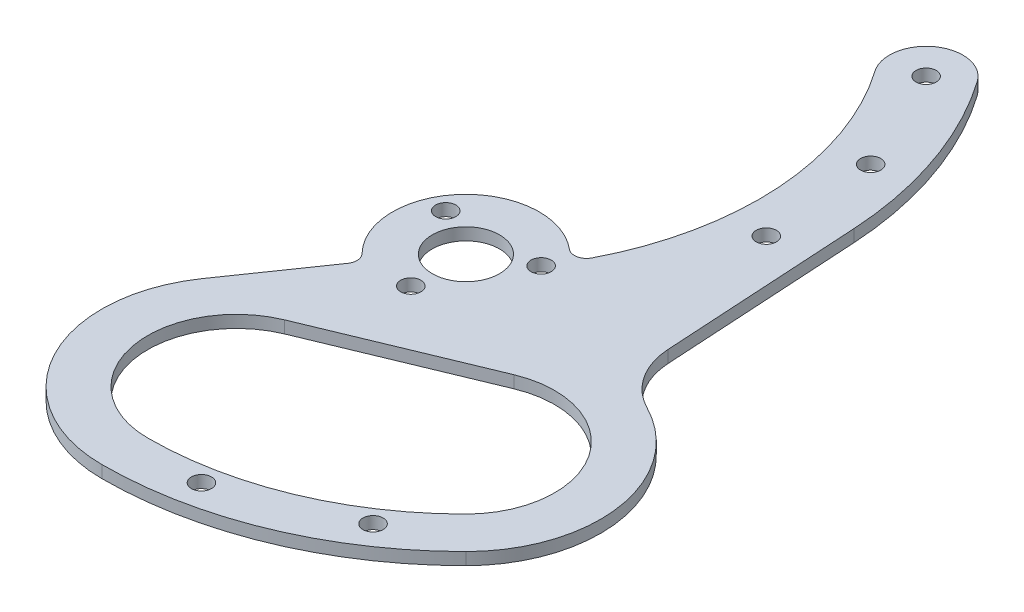
from build123d import *

# Parameters (mm, degrees)
SKETCH_1_R          = 1.65
SKETCH_1_R_2        = 5.5
EXTRUDE_1_DEPTH     = 2
SKETCH_2_R          = 1.65
CUT_EXTRUDE_1_DEPTH = 85.204030668
FILLET_1_R          = 2
FILLET_2_R          = 12


with BuildPart() as part:
    # Эскиз1 → Бобышка-Вытянуть1 (new body)
    with BuildSketch(Plane(origin=(0, 0, 0), x_dir=(1, 0, 0), z_dir=(0, 1, 0))):
        with BuildLine():
            Line((-7.358068948, -9.479389292), (-18.08780174, -24.976764467))
            ThreePointArc((-18.08780174, -24.976764467), (-19.487318719, -47.710015139), (0, -59.5))
            ThreePointArc((0, -59.5), (22.769664226, -54.970832184), (42.072853481, -42.072853481))
            ThreePointArc((42.072853481, -42.072853481), (47.515690449, -19.956460022), (30.451246794, -4.87123226))
            Line((30.451246794, -4.87123226), (28.075866666, 35.356540564))
            ThreePointArc((28.075866666, 35.356540564), (24.846341863, 51.541564262), (17.329317504, 66.234391334))
            ThreePointArc((17.329317504, 66.234391334), (8.97294662, 67.707844982), (7.499492972, 59.351474098))
            ThreePointArc((7.499492972, 59.351474098), (16.145431017, 33.64630977), (9.479389292, 7.358068948))
            ThreePointArc((9.479389292, 7.358068948), (-8.485281374, 8.485281374), (-7.358068948, -9.479389292))
        make_face()
        with Locations(Location((10.729446295, -53.940569088, 0), (0, 0, 270))):
            Circle(SKETCH_1_R, mode=Mode.SUBTRACT)
        with Locations(Location((30.554877949, -45.728606417, 0), (0, 0, 90))):
            Circle(SKETCH_1_R, mode=Mode.SUBTRACT)
        with Locations(Location((0, 0, 0), (0, 0, 270))):
            Circle(SKETCH_1_R_2, mode=Mode.SUBTRACT)
        with Locations(Location((0, -9, 0), (0, 0, 270))):
            Circle(SKETCH_1_R, mode=Mode.SUBTRACT)
        with Locations(Location((-7.794228634, 4.5, 0), (0, 0, 270))):
            Circle(SKETCH_1_R, mode=Mode.SUBTRACT)
        with Locations(Location((7.794228634, 4.5, 0), (0, 0, 270))):
            Circle(SKETCH_1_R, mode=Mode.SUBTRACT)
        with BuildLine():
            Line((-5.548909769, -24.103746779), (20.967594525, -13.120251073))
            ThreePointArc((20.967594525, -13.120251073), (38.572813673, -18.460735916), (36.769552622, -36.769552622))
            ThreePointArc((36.769552622, -36.769552622), (19.899538483, -48.041735691), (0, -52))
            ThreePointArc((0, -52), (-14.221386566, -40.328809669), (-5.548909769, -24.103746779))
        make_face(mode=Mode.SUBTRACT)
    extrude(amount=EXTRUDE_1_DEPTH)

    # Эскиз2 → Вырез-Вытянуть1 (cut, through all)
    with BuildSketch(Plane.XZ):
        with Locations(Location((21.974708544, -27.113395045, 0), (0, 0, 270))):
            Circle(SKETCH_2_R)
        with Locations(Location((12.414405238, -62.792932716, 0), (0, 0, 270))):
            Circle(SKETCH_2_R)
        with Locations(Location((20.340189466, -45.796033589, 0), (0, 0, 270))):
            Circle(SKETCH_2_R)
    extrude(amount=-CUT_EXTRUDE_1_DEPTH, mode=Mode.SUBTRACT)

    # Скругление1
    fillet_1_edges = [part.edges().sort_by_distance(p)[0] for p in [
        (-7.358068948, 1, 9.479389292),
        (9.479389292, 1, -7.358068948),
    ]]
    fillet(fillet_1_edges, radius=FILLET_1_R)

    # Скругление2
    fillet_2_edges = [part.edges().sort_by_distance(p)[0] for p in [
        (30.451246794, 1, 4.87123226),
    ]]
    fillet(fillet_2_edges, radius=FILLET_2_R)


solid = part.part
